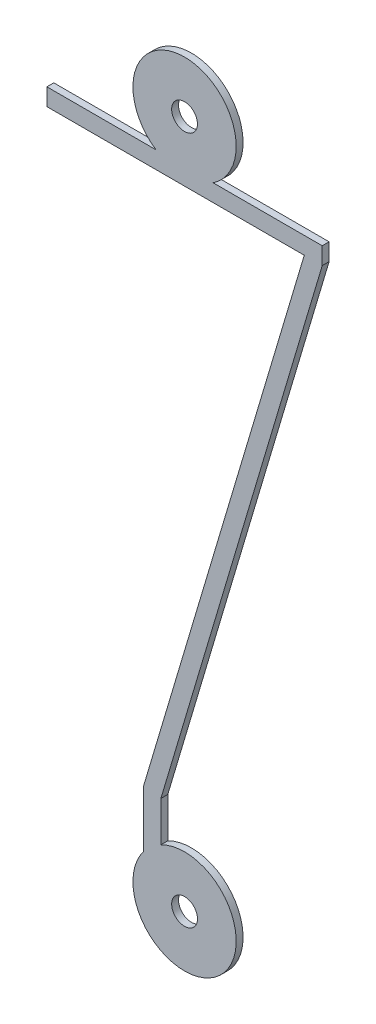
from build123d import *

# Parameters (mm, degrees)
SKETCH1_R           = 0.375
BOSS_EXTRUDE1_DEPTH = 0.1


with BuildPart() as part:
    # Sketch1 → Boss-Extrude1 (new, symmetric)
    with BuildSketch(Plane.XY):
        with BuildLine():
            Line((-4, 8.75), (-0.829156198, 8.75))
            ThreePointArc((-0.829156198, 8.75), (0, 11.5), (0.829156198, 8.75))
            Line((0.829156198, 8.75), (4, 8.75))
            Line((4, 8.75), (4, 8.25))
            Line((4, 8.25), (-0.6875, -7.5))
            Line((-0.6875, -7.5), (-0.6875, -8.666829437))
            ThreePointArc((-0.6875, -8.666829437), (0.960377242, -11.152248043), (-1.1875, -9.083570106))
            Line((-1.1875, -9.083570106), (-1.1875, -7.427173711))
            Line((-1.1875, -7.427173711), (3.478325509, 8.25))
            Line((3.478325509, 8.25), (-4, 8.25))
            Line((-4, 8.25), (-4, 8.75))
        make_face()
        with Locations((0, 10)):
            Circle(SKETCH1_R, mode=Mode.SUBTRACT)
        with Locations((0, -10)):
            Circle(SKETCH1_R, mode=Mode.SUBTRACT)
    extrude(amount=BOSS_EXTRUDE1_DEPTH, both=True)


solid = part.part
